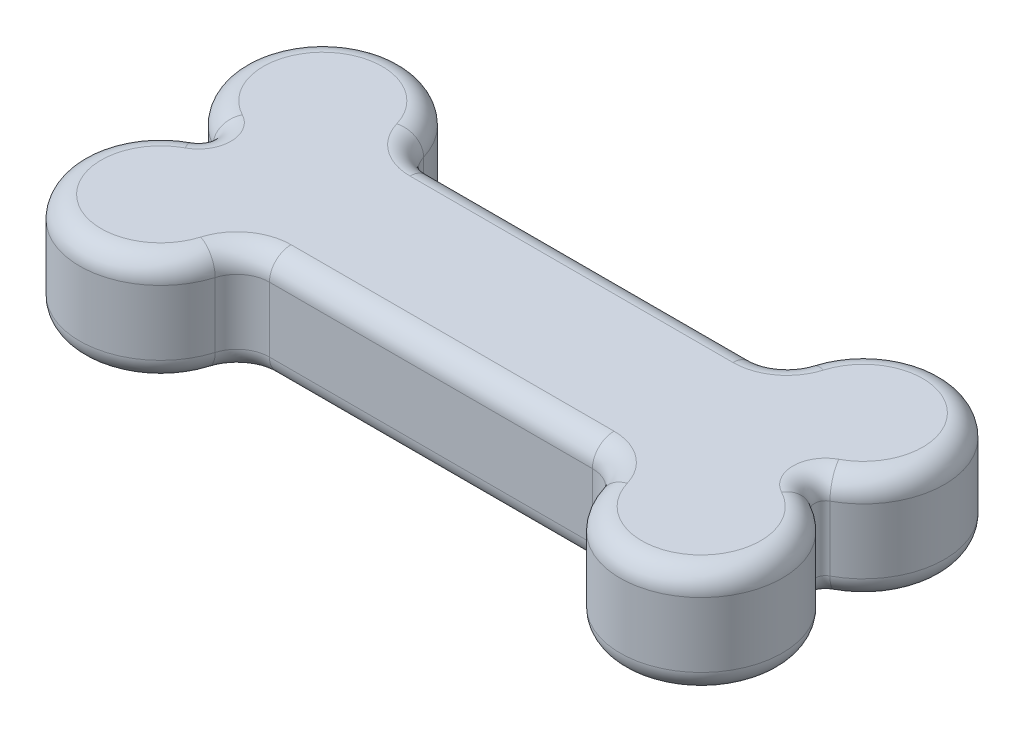
from build123d import *

# Parameters (mm, degrees)
BOSS_EXTRUDE1_DEPTH = 10
FILLET3_R           = 3
FILLET4_R           = 1
FILLET5_R           = 2


with BuildPart() as part:
    # Sketch1 → Boss-Extrude1 (new body)
    with BuildSketch(Plane(origin=(0, 0, 0), x_dir=(1, 0, 0), z_dir=(0, 1, 0))):
        with BuildLine():
            Line((-17.5, -7.5), (17.5, -7.5))
            ThreePointArc((17.5, -7.5), (30.303300859, -12.803300859), (25, 0))
            ThreePointArc((25, 0), (30.303300859, 12.803300859), (17.5, 7.5))
            Line((17.5, 7.5), (-17.5, 7.5))
            ThreePointArc((-17.5, 7.5), (-30.303300859, 12.803300859), (-25, 0))
            ThreePointArc((-25, 0), (-30.303300859, -12.803300859), (-17.5, -7.5))
        make_face()
    extrude(amount=BOSS_EXTRUDE1_DEPTH)

    # Fillet3
    fillet3_edges = [part.edges().sort_by_distance(p)[0] for p in [
        (17.5, 5, 7.5),
        (-17.5, 5, 7.5),
        (-17.5, 5, -7.5),
        (17.5, 5, -7.5),
    ]]
    fillet(fillet3_edges, radius=FILLET3_R)

    # Fillet4
    fillet4_edges = [part.edges().sort_by_distance(p)[0] for p in [
        (-25, 5, 0),
        (25, 5, 0),
    ]]
    fillet(fillet4_edges, radius=FILLET4_R)

    # Fillet5
    fillet5_edges = [part.edges().sort_by_distance(p)[0] for p in [
        (-29.74676282, 0, -13.306741145),
        (-29.74676282, 10, -13.306741145),
        (0, 0, -7.5),
        (0, 10, -7.5),
        (29.74676282, 0, 13.306741145),
        (29.74676282, 10, 13.306741145),
        (0, 0, 7.5),
        (0, 10, 7.5),
        (-16.730537015, 0, -8.094648823),
        (-16.730537015, 10, -8.094648823),
        (16.730537015, 0, -8.094648823),
        (16.730537015, 10, -8.094648823),
        (16.730537015, 0, 8.094648823),
        (16.730537015, 10, 8.094648823),
        (-16.730537015, 0, 8.094648823),
        (-16.730537015, 10, 8.094648823),
        (-29.74676282, 0, 13.306741145),
        (-29.74676282, 10, 13.306741145),
        (29.74676282, 0, -13.306741145),
        (29.74676282, 10, -13.306741145),
        (-28, 0, 0),
        (-28, 10, 0),
        (28, 0, 0),
        (28, 10, 0),
    ]]
    fillet(fillet5_edges, radius=FILLET5_R)


solid = part.part
